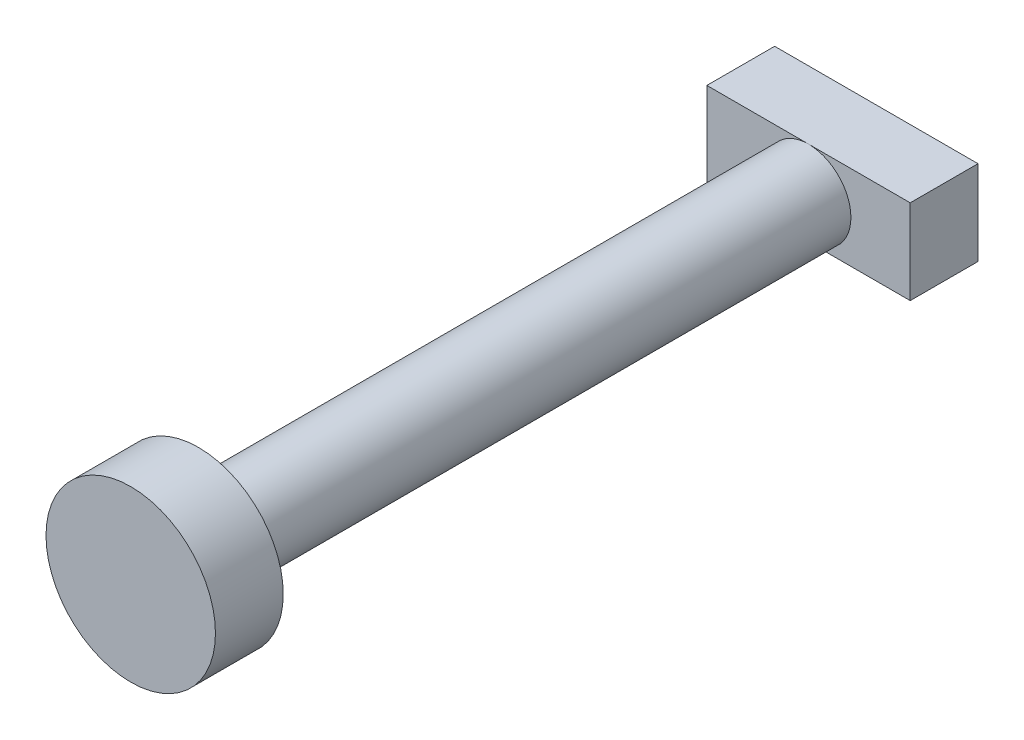
from build123d import *

# Parameters (mm, degrees)
SKETCH1_R           = 1.25
BOSS_EXTRUDE1_DEPTH = 9
SKETCH2_R           = 2.5
BOSS_EXTRUDE2_DEPTH = 2
SKETCH3_W           = 6
SKETCH3_H           = 2.5
BOSS_EXTRUDE3_DEPTH = 2


with BuildPart() as part:
    # Sketch1 → Boss-Extrude1 (new, symmetric)
    with BuildSketch(Plane.XY):
        Circle(SKETCH1_R)
    extrude(amount=BOSS_EXTRUDE1_DEPTH, both=True)

    # Sketch2 → Boss-Extrude2 (add)
    with BuildSketch(Plane.XY.offset(9)):
        Circle(SKETCH2_R)
    extrude(amount=BOSS_EXTRUDE2_DEPTH)

    # Sketch3 → Boss-Extrude3 (add)
    with BuildSketch(Plane(origin=(0, 0, -9), x_dir=(-1, 0, 0), z_dir=(0, 0, -1))):
        Rectangle(SKETCH3_W, SKETCH3_H)
    extrude(amount=BOSS_EXTRUDE3_DEPTH)


solid = part.part
